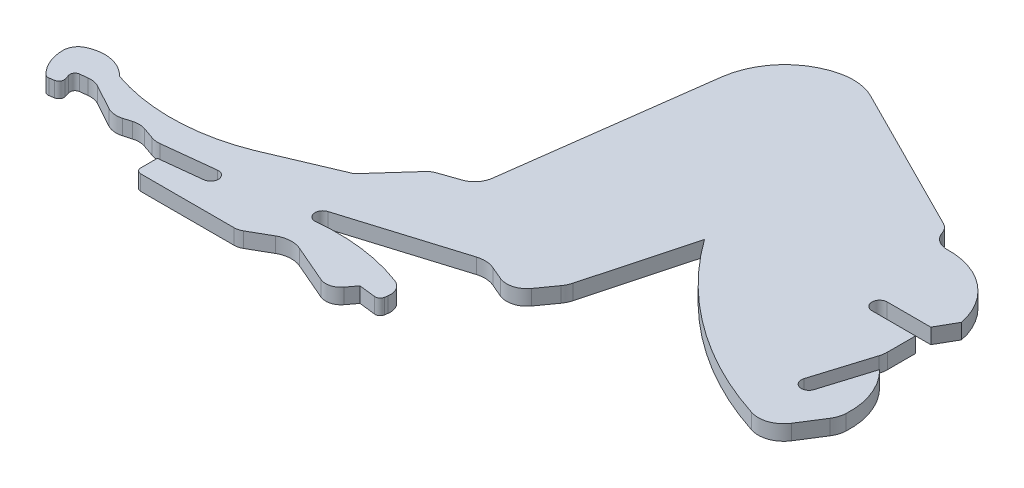
from build123d import *

# Parameters (mm, degrees)
BOSS_EXTRUDE1_DEPTH = 3
FILLET1_R           = 3
FILLET2_R           = 5
FILLET3_R           = 4
FILLET4_R           = 1
FILLET5_R           = 10


with BuildPart() as part:
    # Sketch2 → Boss-Extrude1 (new body)
    with BuildSketch(Plane(origin=(0, 0, 0), x_dir=(1, 0, 0), z_dir=(0, 1, 0))):
        with BuildLine():
            Line((104.861742338, 51.61), (96.285742338, 51.61))
            ThreePointArc((96.285742338, 51.61), (94.785742338, 50.11), (96.285742338, 48.61))
            Line((96.285742338, 48.61), (104.861742338, 48.61))
            Line((104.861742338, 48.61), (104.861742338, 42.36))
            Line((104.861742338, 42.36), (101.159535482, 30.341590159))
            ThreePointArc((101.159535482, 30.341590159), (102.15147179, 28.466473533), (104.026588416, 29.458409841))
            Line((104.026588416, 29.458409841), (107.0705594, 39.34))
            ThreePointArc((107.0705594, 39.34), (110.559148386, 33.719570051), (111.09, 27.125809175))
            Line((111.09, 27.125809175), (105.531161353, 18.360668643))
            ThreePointArc((105.531161353, 18.360668643), (84.319857644, 28.006827284), (67.651742338, 44.29))
            Line((67.651742338, 44.29), (61.935762488, 23.027584397))
            Line((61.935762488, 23.027584397), (57.13, 16.32))
            Line((57.13, 16.32), (49.95, 19.39))
            Line((49.95, 19.39), (25.830040494, 11.99))
            ThreePointArc((25.830040494, 11.99), (24.800734775, 10.253880031), (26.431506195, 9.064692331))
            ThreePointArc((26.431506195, 9.064692331), (36.664028635, 8.803570476), (46.46571567, 5.854056721))
            Line((46.46571567, 5.854056721), (45.9, 1.991540554))
            Line((45.9, 1.991540554), (41.660045255, 2.482673431))
            Line((41.660045255, 2.482673431), (38.9, -1.2))
            Line((38.9, -1.2), (27.015518097, 3.924692331))
            Line((27.015518097, 3.924692331), (20.16, 0))
            Line((20.16, 0), (0, 0))
            Line((0, 0), (0, 4.28))
            Line((0, 4.28), (8.255364291, 5.2))
            ThreePointArc((8.255364291, 5.2), (9.58, 6.856906829), (7.923093171, 8.181542538))
            Line((7.923093171, 8.181542538), (-3.121398875, 6.950714639))
            Line((-3.121398875, 6.950714639), (-7.499203077, 8.482641989))
            Line((-7.499203077, 8.482641989), (-11.827625236, 7.22158903))
            Line((-11.827625236, 7.22158903), (-19.255161489, 11.297641869))
            Line((-19.255161489, 11.297641869), (-23.205269456, 10.857431213))
            Line((-23.205269456, 10.857431213), (-22.269740859, 7.646334739))
            Line((-22.269740859, 7.646334739), (-24.812537217, 7.22158903))
            ThreePointArc((-24.812537217, 7.22158903), (-27.256062178, 10.796585791), (-27.5, 15.12))
            ThreePointArc((-27.5, 15.12), (-22.484233626, 16.792009689), (-17.704912147, 14.531121607))
            ThreePointArc((-17.704912147, 14.531121607), (-4.702395419, 12.521774189), (8.186937419, 15.161474421))
            Line((8.186937419, 15.161474421), (21.991482078, 21.019847276))
            Line((21.991482078, 21.019847276), (29.148159429, 28.986869108))
            Line((29.148159429, 28.986869108), (36.03, 31.378427725))
            Line((36.03, 31.378427725), (41.652863678, 73.662098134))
            ThreePointArc((41.652863678, 73.662098134), (47.001876481, 83.094401265), (57.4, 86.17))
            Line((57.4, 86.17), (89.772823478, 69.836247096))
            ThreePointArc((89.772823478, 69.836247096), (90.799785464, 67.40403524), (93.25912827, 66.443859006))
            ThreePointArc((93.25912827, 66.443859006), (102.166931279, 63.469413825), (107.0705594, 55.46))
            Line((107.0705594, 55.46), (104.861742338, 51.61))
        make_face()
    extrude(amount=BOSS_EXTRUDE1_DEPTH)

    # Fillet1
    fillet1_edges = [part.edges().sort_by_distance(p)[0] for p in [
        (46.46571567, 1.5, -5.854056721),
        (38.9, 1.5, 1.2),
        (20.16, 1.5, 0),
        (-27.5, 1.5, -15.12),
        (29.148159429, 1.5, -28.986869108),
        (89.772823478, 1.5, -69.836247096),
    ]]
    fillet(fillet1_edges, radius=FILLET1_R)

    # Fillet2
    fillet2_edges = [part.edges().sort_by_distance(p)[0] for p in [
        (104.861742338, 1.5, -42.36),
        (111.09, 1.5, -27.125809175),
        (105.531161353, 1.5, -18.360668643),
        (61.935762488, 1.5, -23.027584397),
        (49.95, 1.5, -19.39),
        (27.015518097, 1.5, -3.924692331),
    ]]
    fillet(fillet2_edges, radius=FILLET2_R)

    # Fillet3
    fillet3_edges = [part.edges().sort_by_distance(p)[0] for p in [
        (57.13, 1.5, -16.32),
        (-3.121398875, 1.5, -6.950714639),
        (-7.499203077, 1.5, -8.482641989),
        (-11.827625236, 1.5, -7.22158903),
        (-19.255161489, 1.5, -11.297641869),
        (36.03, 1.5, -31.378427725),
    ]]
    fillet(fillet3_edges, radius=FILLET3_R)

    # Fillet4
    fillet4_edges = [part.edges().sort_by_distance(p)[0] for p in [
        (45.9, 1.5, -1.991540554),
        (0, 1.5, 0),
        (-23.205269456, 1.5, -10.857431213),
        (-22.269740859, 1.5, -7.646334739),
        (-24.812537217, 1.5, -7.22158903),
    ]]
    fillet(fillet4_edges, radius=FILLET4_R)

    # Fillet5
    fillet5_edges = [part.edges().sort_by_distance(p)[0] for p in [
        (57.4, 1.5, -86.17),
    ]]
    fillet(fillet5_edges, radius=FILLET5_R)


solid = part.part
